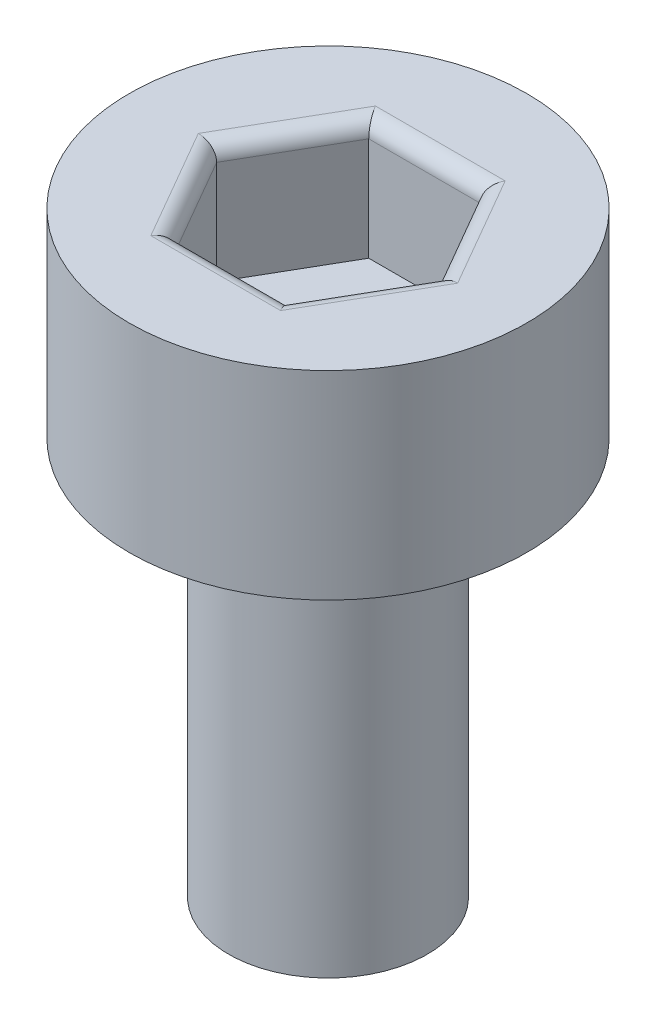
from build123d import *

# Parameters (mm, degrees)
SKETCH_1_R          = 2.5
EXTRUDE_1_DEPTH     = 2.5
CUT_EXTRUDE_1_DEPTH = 1.5
SKETCH_5_R          = 1.25
EXTRUDE_2_DEPTH     = 5
FILLET_1_R          = 0.2


with BuildPart() as part:
    # 草图1 → 凸台-拉伸1 (new body)
    with BuildSketch(Plane(origin=(0, 0, 0), x_dir=(1, 0, 0), z_dir=(0, 1, 0))):
        with Locations(Location((0, 0, 0), (0, 0, 270))):
            Circle(SKETCH_1_R)
    extrude(amount=EXTRUDE_1_DEPTH)

    # 草图2 → 切除-拉伸1 (cut)
    with BuildSketch(Plane(origin=(0, 2.5, 0), x_dir=(1, 0, 0), z_dir=(0, 1, 0))):
        Polygon((-0.7, 1.212435565), (0.7, 1.212435565), (1.4, 0), (0.7, -1.212435565), (-0.7, -1.212435565), (-1.4, 0), align=None)
    extrude(amount=-CUT_EXTRUDE_1_DEPTH, mode=Mode.SUBTRACT)

    # 草图5 → 凸台-拉伸2 (add)
    with BuildSketch(Plane.XZ):
        with Locations(Location((0, 0, 0), (0, 0, 270))):
            Circle(SKETCH_5_R)
    extrude(amount=EXTRUDE_2_DEPTH)

    # 圆角1
    fillet_1_edges = [part.edges().sort_by_distance(p)[0] for p in [
        (1.05, 2.5, -0.606217783),
        (1.05, 2.5, 0.606217783),
        (0, 2.5, 1.212435565),
        (-1.05, 2.5, 0.606217783),
        (-1.05, 2.5, -0.606217783),
        (0, 2.5, -1.212435565),
    ]]
    fillet(fillet_1_edges, radius=FILLET_1_R)


solid = part.part
